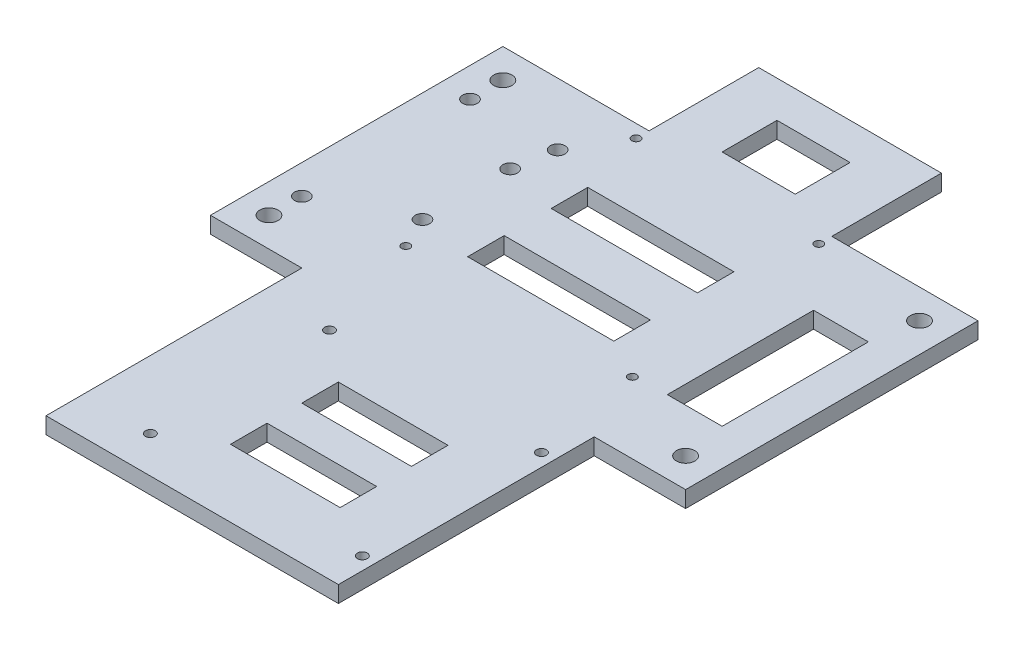
from build123d import *

# Parameters (mm, degrees)
SKETCH_2_W          = 130
SKETCH_2_H          = 80
SKETCH_2_R          = 2.5
EXTRUDE_1_DEPTH     = 4.5
SKETCH_4_W          = 80
SKETCH_4_H          = 70
EXTRUDE_2_DEPTH     = 4.5
SKETCH_6_R          = 1.15
CUT_EXTRUDE_2_DEPTH = 4.5
SKETCH_7_R          = 1.15
CUT_EXTRUDE_3_DEPTH = 4.5
SKETCH_8_R          = 1.35
CUT_EXTRUDE_4_DEPTH = 10
SKETCH_9_W          = 40
SKETCH_9_H          = 10
SKETCH_9_W_2        = 30
CUT_EXTRUDE_5_DEPTH = 10
SKETCH_11_W         = 50
SKETCH_11_H         = 30
EXTRUDE_3_DEPTH     = 4.5
SKETCH_12_W         = 20
SKETCH_12_H         = 15
CUT_EXTRUDE_6_DEPTH = 10
SKETCH_13_R         = 2
CUT_EXTRUDE_7_DEPTH = 10
SKETCH_14_R         = 2
CUT_EXTRUDE_8_DEPTH = 10
SKETCH_15_W         = 15
SKETCH_15_H         = 40
CUT_EXTRUDE_9_DEPTH = 10


with BuildPart() as part:
    # 草图2 → 凸台-拉伸1 (new body)
    with BuildSketch(Plane(origin=(0, 0, 0), x_dir=(1, 0, 0), z_dir=(0, 1, 0))):
        with Locations((0, 15)):
            Rectangle(SKETCH_2_W, SKETCH_2_H)
        with Locations(Location((-57, 47, 0), (0, 0, 270))):
            Circle(SKETCH_2_R, mode=Mode.SUBTRACT)
        with Locations(Location((57, 47, 0), (0, 0, 90))):
            Circle(SKETCH_2_R, mode=Mode.SUBTRACT)
        with Locations(Location((57, -17, 0), (0, 0, 270))):
            Circle(SKETCH_2_R, mode=Mode.SUBTRACT)
        with Locations(Location((-57, -17, 0), (0, 0, 90))):
            Circle(SKETCH_2_R, mode=Mode.SUBTRACT)
    extrude(amount=EXTRUDE_1_DEPTH)

    # 草图4 → 凸台-拉伸2 (add)
    with BuildSketch(Plane.XZ):
        with Locations((0, 60)):
            Rectangle(SKETCH_4_W, SKETCH_4_H)
    extrude(amount=-EXTRUDE_2_DEPTH)

    # 草图6 → 切除-拉伸2 (cut)
    with BuildSketch(Plane.XZ):
        with Locations(Location((-31, 5.56384156, 0), (0, 0, 270))):
            Circle(SKETCH_6_R)
        with Locations(Location((31, 5.56384156, 0), (0, 0, 270))):
            Circle(SKETCH_6_R)
    extrude(amount=-CUT_EXTRUDE_2_DEPTH, mode=Mode.SUBTRACT)

    # 草图7 → 切除-拉伸3 (cut)
    with BuildSketch(Plane.XZ):
        with Locations(Location((31, 5.56384156, 0), (0, 0, 270))):
            Circle(SKETCH_7_R)
        with Locations(Location((-25, -51.43615844, 0), (0, 0, 270))):
            Circle(SKETCH_7_R)
        with Locations(Location((25, -51.43615844, 0), (0, 0, 270))):
            Circle(SKETCH_7_R)
    extrude(amount=-CUT_EXTRUDE_3_DEPTH, mode=Mode.SUBTRACT)

    # 草图8 → 切除-拉伸4 (cut)
    with BuildSketch(Plane.XZ):
        with Locations(Location((-21.50477, 84.936614939, 0), (0, 0, 270))):
            Circle(SKETCH_8_R)
        with Locations(Location((36.4733, 84.920764939, 0), (0, 0, 270))):
            Circle(SKETCH_8_R)
        with Locations(Location((36.4823, 35.933764939, 0), (0, 0, 270))):
            Circle(SKETCH_8_R)
        with Locations(Location((-21.5077, 35.922764939, 0), (0, 0, 270))):
            Circle(SKETCH_8_R)
    extrude(amount=-CUT_EXTRUDE_4_DEPTH, mode=Mode.SUBTRACT)

    # 草图9 → 切除-拉伸5 (cut)
    with BuildSketch(Plane.XZ):
        with Locations((0, -5.362073184)):
            Rectangle(SKETCH_9_W, SKETCH_9_H)
        with Locations((0, -28.22464148)):
            Rectangle(SKETCH_9_W, SKETCH_9_H)
        with Locations((7, 71.526054591)):
            Rectangle(SKETCH_9_W_2, SKETCH_9_H)
        with Locations((7, 52.012779739)):
            Rectangle(SKETCH_9_W_2, SKETCH_9_H)
    extrude(amount=-CUT_EXTRUDE_5_DEPTH, mode=Mode.SUBTRACT)

    # 草图11 → 凸台-拉伸3 (add)
    with BuildSketch(Plane.XZ):
        with Locations((0, -70)):
            Rectangle(SKETCH_11_W, SKETCH_11_H)
    extrude(amount=-EXTRUDE_3_DEPTH)

    # 草图12 → 切除-拉伸6 (cut)
    with BuildSketch(Plane.XZ):
        with Locations((0, -67.5)):
            Rectangle(SKETCH_12_W, SKETCH_12_H)
    extrude(amount=-CUT_EXTRUDE_6_DEPTH, mode=Mode.SUBTRACT)

    # 草图13 → 切除-拉伸7 (cut)
    with BuildSketch(Plane.XZ):
        with Locations(Location((-57, 8, 0), (0, 0, 270))):
            Circle(SKETCH_13_R)
        with Locations(Location((-57, -38, 0), (0, 0, 270))):
            Circle(SKETCH_13_R)
        with Locations(Location((-33, -38, 0), (0, 0, 270))):
            Circle(SKETCH_13_R)
    extrude(amount=-CUT_EXTRUDE_7_DEPTH, mode=Mode.SUBTRACT)

    # 草图14 → 切除-拉伸8 (cut)
    with BuildSketch(Plane.XZ):
        with Locations(Location((-35, -27, 0), (0, 0, 270))):
            Circle(SKETCH_14_R)
        with Locations(Location((-35, -3, 0), (0, 0, 270))):
            Circle(SKETCH_14_R)
    extrude(amount=-CUT_EXTRUDE_8_DEPTH, mode=Mode.SUBTRACT)

    # 草图15 → 切除-拉伸9 (cut)
    with BuildSketch(Plane.XZ):
        with Locations((47.5, -15)):
            Rectangle(SKETCH_15_W, SKETCH_15_H)
    extrude(amount=-CUT_EXTRUDE_9_DEPTH, mode=Mode.SUBTRACT)


solid = part.part
